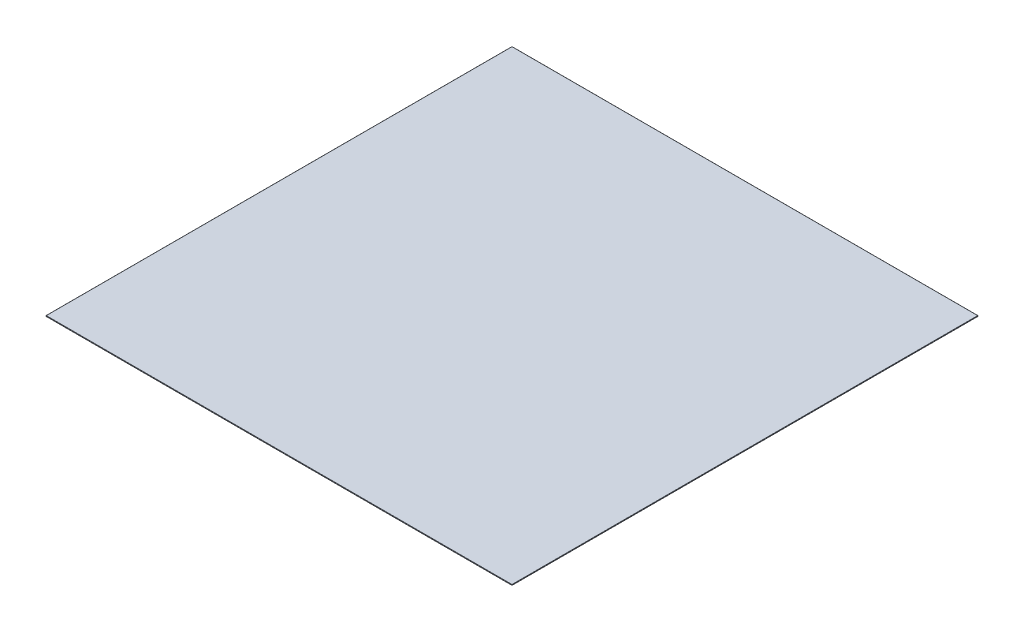
from build123d import *

# Parameters (mm, degrees)
SKETCH1_W           = 2000
SKETCH1_H           = 2000
BOSS_EXTRUDE1_DEPTH = 3.175
FILLET1_R           = 1


with BuildPart() as part:
    # Sketch1 → Boss-Extrude1 (new body)
    with BuildSketch(Plane(origin=(0, 0, 0), x_dir=(1, 0, 0), z_dir=(0, 1, 0))):
        with Locations((1000, -1000)):
            Rectangle(SKETCH1_W, SKETCH1_H)
    extrude(amount=BOSS_EXTRUDE1_DEPTH)

    # Fillet1
    fillet1_edges = [part.edges().sort_by_distance(p)[0] for p in [
        (2000, 3.175, 1000),
        (1000, 3.175, 0),
        (0, 3.175, 1000),
        (1000, 0, 0),
        (2000, 0, 1000),
        (1000, 0, 2000),
        (0, 0, 1000),
        (1000, 3.175, 2000),
        (0, 1.5875, 0),
        (2000, 1.5875, 0),
        (2000, 1.5875, 2000),
        (0, 1.5875, 2000),
    ]]
    fillet(fillet1_edges, radius=FILLET1_R)


solid = part.part
